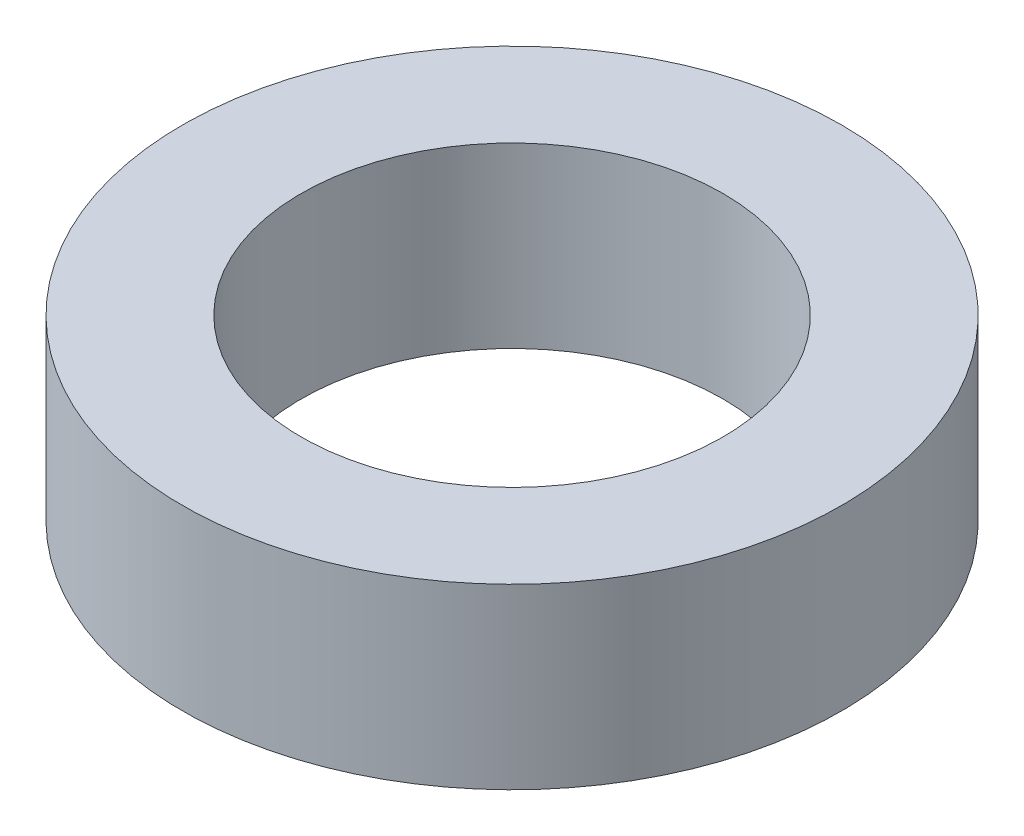
from build123d import *

# Parameters (mm, degrees)
SKETCH_1_R      = 2.5
SKETCH_1_R_2    = 1.6
EXTRUDE_1_DEPTH = 1.35


with BuildPart() as part:
    # 草图1 → 凸台-拉伸1 (new body)
    with BuildSketch(Plane(origin=(0, 0, 0), x_dir=(1, 0, 0), z_dir=(0, 1, 0))):
        with Locations(Location((0, 0, 0), (0, 0, 90))):
            Circle(SKETCH_1_R)
        with Locations(Location((0, 0, 0), (0, 0, 90))):
            Circle(SKETCH_1_R_2, mode=Mode.SUBTRACT)
    extrude(amount=EXTRUDE_1_DEPTH)


solid = part.part
